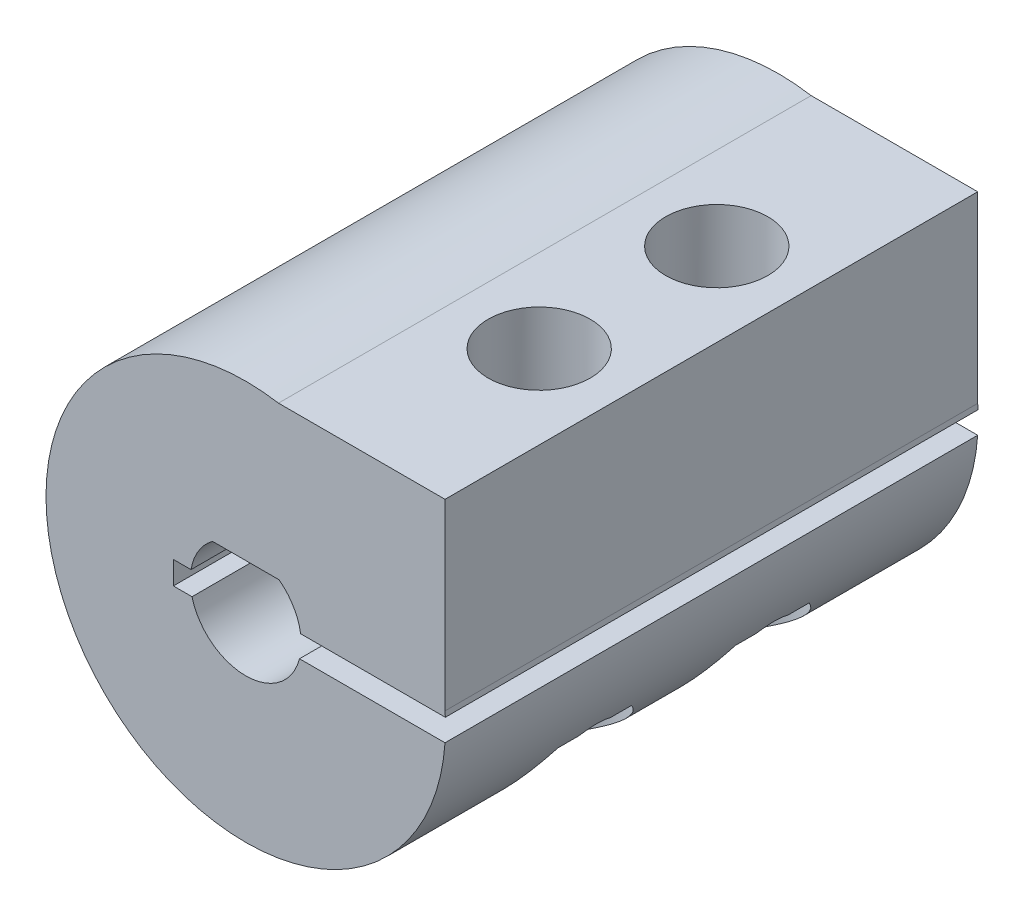
from build123d import *

# Parameters (mm, degrees)
BOSS_EXTRUDE1_DEPTH     = 8
SKETCH3_R               = 1.95
CUT_EXTRUDE1_DEPTH      = 8
SKETCH4_R               = 1.5
CUT_EXTRUDE2_DEPTH      = 8
SKETCH5_R               = 2.6
CUT_EXTRUDE3_DEPTH      = 8
BOSS_EXTRUDE2_START     = 12
BOSS_EXTRUDE2_DEPTH     = 12
CUT_EXTRUDE4_START      = -2
SKETCH7_R               = 2.3
CUT_EXTRUDE4_DEPTH      = 12
SKETCH9_W               = 7.513516272
SKETCH9_H               = 8
SKETCH9_R               = 2.3
BOSS_EXTRUDE3_DEPTH     = 8.5
MIRROR3_START           = -2
MIRROR3_COPY_1_SKETCH_R = 2.3
MIRROR3_COPY_1_DEPTH    = 12
MIRROR3_COPY_2_SKETCH_R = 2.3
MIRROR3_COPY_2_DEPTH    = 12
CUT_EXTRUDE7_START      = -2
SKETCH10_R              = 3
CUT_EXTRUDE7_DEPTH      = 8.5
BOSS_EXTRUDE6_DEPTH     = 4
CUT_EXTRUDE8_DEPTH      = 8
CUT_EXTRUDE9_START      = 4
CUT_EXTRUDE9_DEPTH      = 4
BOSS_EXTRUDE7_START     = 4
BOSS_EXTRUDE7_DEPTH     = 4


with BuildPart() as part:
    # Sketch1 → Boss-Extrude1 (new body)
    with BuildSketch(Plane.XY):
        with BuildLine():
            Line((-2.444403469, -0.621537143), (-1.365170898, -0.621537143))
            ThreePointArc((-1.365170898, -0.621537143), (0, -1.5), (1.365170898, -0.621537143))
            Line((1.365170898, -0.621537143), (8.978512771, -0.621537143))
            ThreePointArc((8.978512771, -0.621537143), (-8.999176795, 0.12172517), (8.992039027, 0.378462857))
            Line((8.992039027, 0.378462857), (1.451470243, 0.378462857))
            ThreePointArc((1.451470243, 0.378462857), (0, 1.5), (-1.451470243, 0.378462857))
            Line((-1.451470243, 0.378462857), (-2.444403469, 0.378462857))
            Line((-2.444403469, 0.378462857), (-2.444403469, -0.621537143))
        make_face()
    extrude(amount=BOSS_EXTRUDE1_DEPTH)

    # Sketch3 → Cut-Extrude1 (cut)
    with BuildSketch(Plane.XZ.offset(-0.378462857)):
        with Locations(Location((5.221754635, 4, 0), (0, 0, 270))):
            Circle(SKETCH3_R)
    cut_extrude1 = extrude(amount=-CUT_EXTRUDE1_DEPTH, mode=Mode.SUBTRACT)

    # Sketch4 → Cut-Extrude2 (cut)
    with BuildSketch(Plane(origin=(0, -0.621537143, 0), x_dir=(1, 0, 0), z_dir=(0, 1, 0))):
        with Locations(Location((5.221754635, -4, 0), (0, 0, 270))):
            Circle(SKETCH4_R)
    cut_extrude2 = extrude(amount=-CUT_EXTRUDE2_DEPTH, mode=Mode.SUBTRACT)

    # Sketch5 → Cut-Extrude3 (cut)
    with BuildSketch(Plane(origin=(0, -2.621537143, 0), x_dir=(1, 0, 0), z_dir=(0, 1, 0))):
        with Locations(Location((5.221754635, -4, 0), (0, 0, 270))):
            Circle(SKETCH5_R)
    cut_extrude3 = extrude(amount=-CUT_EXTRUDE3_DEPTH, mode=Mode.SUBTRACT)

    # Sketch6 → Boss-Extrude2 (add)
    with BuildSketch(Plane(origin=(0, 0, 0), x_dir=(-1, 0, 0), z_dir=(0, 0, -1)).offset(BOSS_EXTRUDE2_START)):
        with BuildLine():
            Line((1.916746353, -0.621537143), (2.444403469, -0.621537143))
            Line((2.444403469, -0.621537143), (2.444403469, 0.378462857))
            Line((2.444403469, 0.378462857), (1.97913892, 0.378462857))
            ThreePointArc((1.97913892, 0.378462857), (0, 2.015), (-1.97913892, 0.378462857))
            Line((-1.97913892, 0.378462857), (-8.992039027, 0.378462857))
            ThreePointArc((-8.992039027, 0.378462857), (8.999176795, 0.12172517), (-8.978512771, -0.621537143))
            Line((-8.978512771, -0.621537143), (-1.916746353, -0.621537143))
            ThreePointArc((-1.916746353, -0.621537143), (0, -2.015), (1.916746353, -0.621537143))
        make_face()
    extrude(amount=-BOSS_EXTRUDE2_DEPTH)

    # Mirror1: Cut-Extrude1, Cut-Extrude2, Cut-Extrude3 across plane
    add(cut_extrude1.mirror(Plane.XY), mode=Mode.SUBTRACT)
    add(cut_extrude2.mirror(Plane.XY), mode=Mode.SUBTRACT)
    add(cut_extrude3.mirror(Plane.XY), mode=Mode.SUBTRACT)

    # Sketch7 → Cut-Extrude4 (cut)
    with BuildSketch(Plane(origin=(0, 3.378462857, 0), x_dir=(-1, 0, 0), z_dir=(0, -1, 0)).offset(CUT_EXTRUDE4_START)):
        with Locations((-5.221754635, 4)):
            Circle(SKETCH7_R)
    cut_extrude4 = extrude(amount=-CUT_EXTRUDE4_DEPTH, mode=Mode.SUBTRACT)

    # Mirror2: Cut-Extrude4 across plane
    add(cut_extrude4.mirror(Plane.XY), mode=Mode.SUBTRACT)

    # Sketch9 → Boss-Extrude3 (add)
    with BuildSketch(Plane.XZ.offset(-0.378462857)):
        with Locations((5.221754635, 4)):
            Rectangle(SKETCH9_W, SKETCH9_H)
        with Locations((5.221754635, 4)):
            Circle(SKETCH9_R, mode=Mode.SUBTRACT)
    boss_extrude3 = extrude(amount=-BOSS_EXTRUDE3_DEPTH)

    # Mirror3: Boss-Extrude3 across plane
    add(boss_extrude3.mirror(Plane.XY))

    # Mirror3 copy 1 sketch → Mirror3 copy 1 (cut)
    with BuildSketch(Plane(origin=(0, 3.378462857, 0), x_dir=(-1, 0, 0), z_dir=(0, -1, 0)).offset(MIRROR3_START)):
        with Locations((-5.221754635, 4)):
            Circle(MIRROR3_COPY_1_SKETCH_R)
    extrude(amount=-MIRROR3_COPY_1_DEPTH, mode=Mode.SUBTRACT)

    # Mirror3 copy 2 sketch → Mirror3 copy 2 (cut)
    with BuildSketch(Plane(origin=(0, 3.378462857, 0), x_dir=(-1, 0, 0), z_dir=(0, -1, 0)).offset(MIRROR3_START)):
        with Locations((-5.221754635, -4)):
            Circle(MIRROR3_COPY_2_SKETCH_R)
    extrude(amount=-MIRROR3_COPY_2_DEPTH, mode=Mode.SUBTRACT)

    # Sketch10 → Cut-Extrude7 (cut)
    with BuildSketch(Plane(origin=(0, -2.621537143, 0), x_dir=(1, 0, 0), z_dir=(0, 1, 0)).offset(CUT_EXTRUDE7_START)):
        with Locations((5.221754635, 4)):
            Circle(SKETCH10_R)
        with Locations((5.221754635, -4)):
            Circle(SKETCH10_R)
    extrude(amount=-CUT_EXTRUDE7_DEPTH, mode=Mode.SUBTRACT)

    # Sketch13 → Boss-Extrude6 (add)
    with BuildSketch(Plane.XY.offset(8)):
        with BuildLine():
            Line((1.451470243, 0.378462857), (8.992039027, 0.378462857))
            ThreePointArc((8.992039027, 0.378462857), (8.986097833, 0.500045738), (8.978512771, 0.621537143))
            Line((8.978512771, 0.621537143), (8.978512771, 8.878462857))
            Line((8.978512771, 8.878462857), (1.474075064, 8.878462857))
            ThreePointArc((1.474075064, 8.878462857), (-7.06234013, -5.578830692), (8.978512771, -0.621537143))
            Line((8.978512771, -0.621537143), (1.365170898, -0.621537143))
            ThreePointArc((1.365170898, -0.621537143), (0, -1.5), (-1.365170898, -0.621537143))
            Line((-1.365170898, -0.621537143), (-2.444403469, -0.621537143))
            Line((-2.444403469, -0.621537143), (-2.444403469, 0.378462857))
            Line((-2.444403469, 0.378462857), (-1.451470243, 0.378462857))
            ThreePointArc((-1.451470243, 0.378462857), (0, 1.5), (1.451470243, 0.378462857))
        make_face()
    extrude(amount=BOSS_EXTRUDE6_DEPTH)

    # Sketch14 → Cut-Extrude8 (cut)
    with BuildSketch(Plane.XY.offset(8)):
        with BuildLine():
            Line((-1.5, 2), (0, 2))
            Line((0, 2), (1.5, 2))
            ThreePointArc((1.5, 2), (1.389680214, -2.078169604), (-2.421333029, -0.622210868))
            Line((-2.421333029, -0.622210868), (-3.260817634, -0.622210868))
            Line((-3.260817634, -0.622210868), (-3.260817634, 0.412138801))
            Line((-3.260817634, 0.412138801), (-2.465794316, 0.412138801))
            ThreePointArc((-2.465794316, 0.412138801), (-2.135932334, 1.299150901), (-1.5, 2))
        make_face()
    extrude(amount=-CUT_EXTRUDE8_DEPTH, mode=Mode.SUBTRACT)

    # Sketch14<2> → Cut-Extrude9 (cut)
    with BuildSketch(Plane.XY.offset(8).offset(CUT_EXTRUDE9_START)):
        with BuildLine():
            Line((-1.5, 2), (0, 2))
            Line((0, 2), (1.5, 2))
            ThreePointArc((1.5, 2), (1.389680214, -2.078169604), (-2.421333029, -0.622210868))
            Line((-2.421333029, -0.622210868), (-3.260817634, -0.622210868))
            Line((-3.260817634, -0.622210868), (-3.260817634, 0.412138801))
            Line((-3.260817634, 0.412138801), (-2.465794316, 0.412138801))
            ThreePointArc((-2.465794316, 0.412138801), (-2.135932334, 1.299150901), (-1.5, 2))
        make_face()
    extrude(amount=-CUT_EXTRUDE9_DEPTH, mode=Mode.SUBTRACT)

    # Sketch15 → Boss-Extrude7 (add)
    with BuildSketch(Plane(origin=(0, 0, -8), x_dir=(-1, 0, 0), z_dir=(0, 0, -1)).offset(BOSS_EXTRUDE7_START)):
        with BuildLine():
            Line((-8.978512771, 8.878462857), (-8.978512771, 0.621537143))
            ThreePointArc((-8.978512771, 0.621537143), (-6.660206729, 6.053234369), (-1.474075064, 8.878462857))
            Line((-1.474075064, 8.878462857), (-8.978512771, 8.878462857))
        make_face()
    extrude(amount=-BOSS_EXTRUDE7_DEPTH)


solid = part.part
